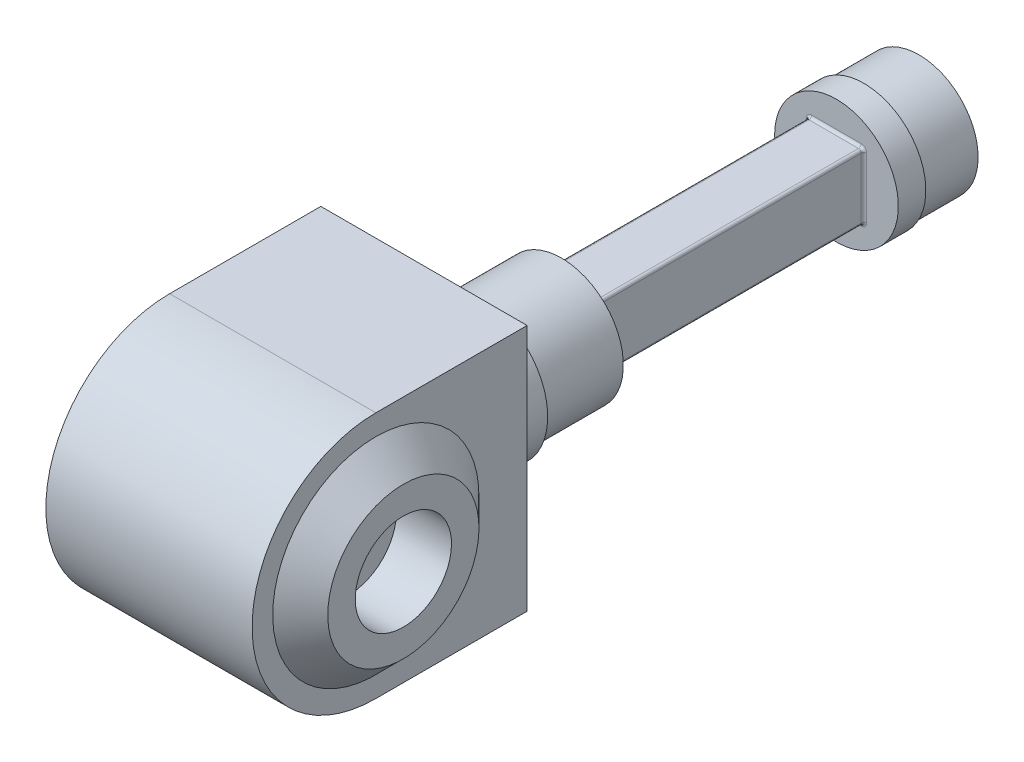
from build123d import *

# Parameters (mm, degrees)
SKETCH1_W           = 75
SKETCH1_H           = 90
BOSS_EXTRUDE1_DEPTH = 50
SKETCH2_W           = 75
SKETCH2_H           = 90
BOSS_EXTRUDE2_DEPTH = 10
BOSS_EXTRUDE2_TAPER = 45
SKETCH3_R           = 25
BOSS_EXTRUDE3_DEPTH = 10
SKETCH4_R           = 22.5
BOSS_EXTRUDE4_DEPTH = 30
SKETCH5_R           = 2.5
CUT_EXTRUDE1_DEPTH  = 5
CIRPATTERN1_COUNT   = 10
SKETCH6_W           = 20
SKETCH6_H           = 24
BOSS_EXTRUDE5_DEPTH = 100
SKETCH7_R           = 22.5
BOSS_EXTRUDE6_DEPTH = 10
SKETCH8_R           = 21.5
BOSS_EXTRUDE7_DEPTH = 20
SKETCH9_R           = 10
CUT_EXTRUDE2_DEPTH  = 10
FILLET1_RADIUS      = 45
FILLET1_LENGTH      = 75
SKETCH10_R          = 37.5
BOSS_EXTRUDE8_DEPTH = 10
BOSS_EXTRUDE8_TAPER = 45
SKETCH11_R          = 17.5
CUT_EXTRUDE3_DEPTH  = 20
FILLET4_R           = 1
FILLET5_R           = 1


with BuildPart() as part:
    # Sketch1 → Boss-Extrude1 (new, symmetric)
    with BuildSketch(Plane.XY):
        Rectangle(SKETCH1_W, SKETCH1_H)
    extrude(amount=BOSS_EXTRUDE1_DEPTH, both=True)

    # Sketch2 → Boss-Extrude2 (add)
    with BuildSketch(Plane(origin=(0, 0, -50), x_dir=(-1, 0, 0), z_dir=(0, 0, -1))):
        Rectangle(SKETCH2_W, SKETCH2_H)
    extrude(amount=BOSS_EXTRUDE2_DEPTH, taper=BOSS_EXTRUDE2_TAPER)

    # Sketch3 → Boss-Extrude3 (add)
    with BuildSketch(Plane(origin=(0, 0, -60), x_dir=(-1, 0, 0), z_dir=(0, 0, -1))):
        Circle(SKETCH3_R)
    extrude(amount=BOSS_EXTRUDE3_DEPTH)

    # Sketch4 → Boss-Extrude4 (add)
    with BuildSketch(Plane(origin=(0, 0, -70), x_dir=(-1, 0, 0), z_dir=(0, 0, -1))):
        Circle(SKETCH4_R)
    extrude(amount=BOSS_EXTRUDE4_DEPTH)

    # Sketch5 → Cut-Extrude1 (cut)
    with BuildSketch(Plane(origin=(0, 0, -100), x_dir=(-1, 0, 0), z_dir=(0, 0, -1))):
        with Locations((18, 0)):
            Circle(SKETCH5_R)
    cut_extrude1 = extrude(amount=-CUT_EXTRUDE1_DEPTH, mode=Mode.SUBTRACT)

    # CirPattern1: Cut-Extrude1 ×10 about axis
    cirpattern1_axis = Axis((0, 0, 0), (0, 0, 1))
    for i in range(1, CIRPATTERN1_COUNT):
        add(cut_extrude1.rotate(cirpattern1_axis, i * 360 / CIRPATTERN1_COUNT), mode=Mode.SUBTRACT)

    # Sketch6 → Boss-Extrude5 (add)
    with BuildSketch(Plane(origin=(0, 0, -100), x_dir=(-1, 0, 0), z_dir=(0, 0, -1))):
        Rectangle(SKETCH6_W, SKETCH6_H)
    extrude(amount=BOSS_EXTRUDE5_DEPTH)

    # Sketch7 → Boss-Extrude6 (add)
    with BuildSketch(Plane(origin=(0, 0, -200), x_dir=(-1, 0, 0), z_dir=(0, 0, -1))):
        Circle(SKETCH7_R)
    extrude(amount=BOSS_EXTRUDE6_DEPTH)

    # Sketch8 → Boss-Extrude7 (add)
    with BuildSketch(Plane(origin=(0, 0, -210), x_dir=(-1, 0, 0), z_dir=(0, 0, -1))):
        Circle(SKETCH8_R)
    extrude(amount=BOSS_EXTRUDE7_DEPTH)

    # Sketch9 → Cut-Extrude2 (cut)
    with BuildSketch(Plane(origin=(0, 0, -230), x_dir=(-1, 0, 0), z_dir=(0, 0, -1))):
        Circle(SKETCH9_R)
    extrude(amount=-CUT_EXTRUDE2_DEPTH, mode=Mode.SUBTRACT)

    # Fillet1: full round fillet: the end face becomes a half cylinder, R = half its width
    fillet1_face = Plane((0, 0, 50), x_dir=(1, 0, 0), z_dir=(0, 0, 1))  # on the end face: x along it, z out of the body
    fillet1_slab = fillet1_face.offset(-FILLET1_RADIUS / 2) * Box(FILLET1_LENGTH, 2 * FILLET1_RADIUS, FILLET1_RADIUS, mode=Mode.PRIVATE)  # the body's end, R deep
    fillet1_round = Plane((0, 0, 5), x_dir=(0, 0, 1), z_dir=(1, 0, 0)) * Cylinder(FILLET1_RADIUS, FILLET1_LENGTH, mode=Mode.PRIVATE)  # its axis R under the face
    add(fillet1_slab - fillet1_round, mode=Mode.SUBTRACT)

    # Sketch10 → Boss-Extrude8 (add)
    with BuildSketch(Plane(origin=(37.5, 0, 0), x_dir=(0, 0, -1), z_dir=(1, 0, 0))):
        with Locations((-5, 0)):
            Circle(SKETCH10_R)
    extrude(amount=BOSS_EXTRUDE8_DEPTH, taper=BOSS_EXTRUDE8_TAPER)

    # Sketch11 → Cut-Extrude3 (cut)
    with BuildSketch(Plane(origin=(47.5, 0, 0), x_dir=(0, 0, -1), z_dir=(1, 0, 0))):
        with Locations(Location((-5, 0, 0), (0, 0, 90))):
            Circle(SKETCH11_R)
    extrude(amount=-CUT_EXTRUDE3_DEPTH, mode=Mode.SUBTRACT)

    # Fillet4
    fillet4_edges = [part.edges().sort_by_distance(p)[0] for p in [
        (25, 0, -60),
    ]]
    fillet(fillet4_edges, radius=FILLET4_R)

    # Fillet5
    fillet5_edges = [part.edges().sort_by_distance(p)[0] for p in [
        (-10, 0, -100),
        (-10, -12, -150),
        (0, 12, -100),
        (-10, 12, -150),
        (10, 0, -100),
        (10, 12, -150),
        (0, -12, -100),
        (10, -12, -150),
        (-10, 0, -200),
        (0, 12, -200),
        (10, 0, -200),
        (0, -12, -200),
    ]]
    fillet(fillet5_edges, radius=FILLET5_R)


solid = part.part
